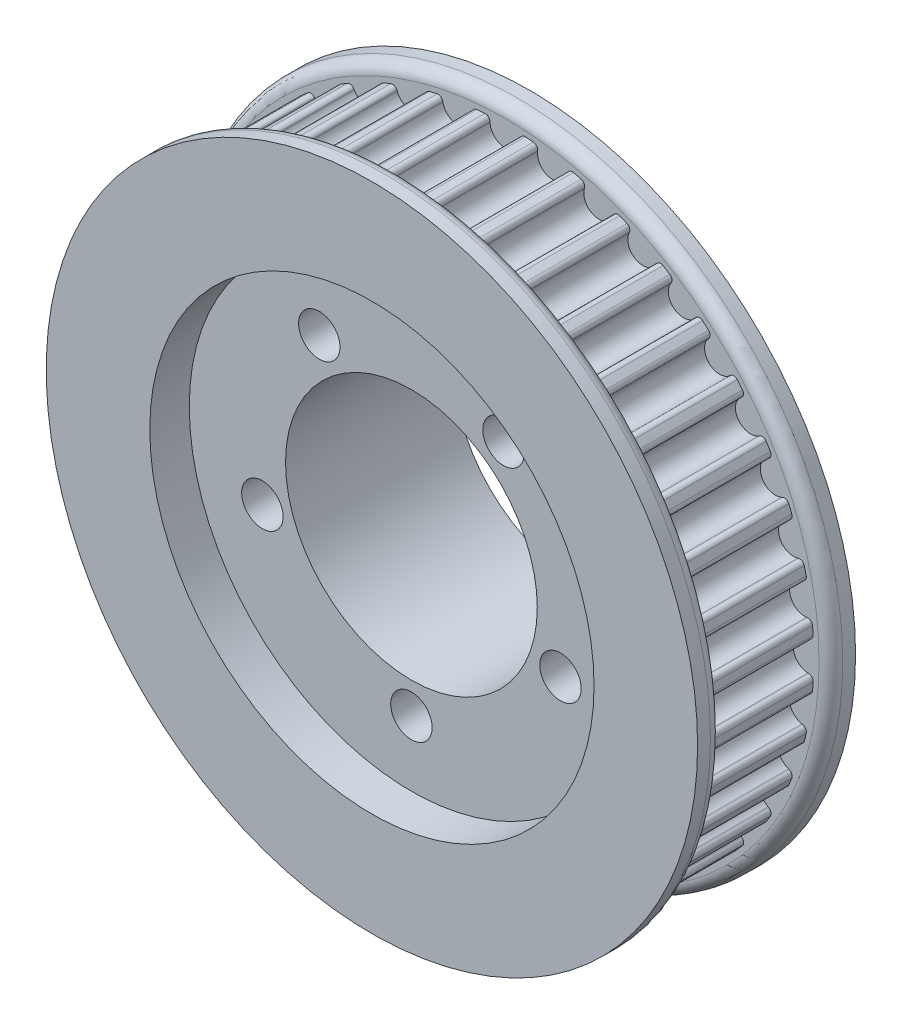
from build123d import *

# Parameters (mm, degrees)
SKETCH_3_R                       = 31.259488618
EXTRUDE_2_DEPTH                  = 5.5
CUT_EXTRUDE_2_DEPTH              = 45.548414757
FILLET_1_R                       = 0.48
PATTERN_CIRCULAR_1_COUNT         = 40
FILLET_1_OF_PATTERN_CIRCULAR_1_R = 0.48
SKETCH_8_R                       = 32.989488618
EXTRUDE_3_DEPTH                  = 2.5
FILLET_2_R                       = 1.2
FILLET_2_OF_MIRROR_1_R           = 1.2
SKETCH_17_R                      = 20
EXTRUDE_4_DEPTH                  = 5
M5X0_8_2_D                       = 4.2
SKETCH_16_R                      = 22.5
CUT_EXTRUDE_4_DEPTH              = 4
SKETCH_18_R                      = 12.75
CUT_EXTRUDE_5_DEPTH              = 52.162610553


with BuildPart() as part:
    # 스케치3 → 보스-돌출2 (new, symmetric)
    with BuildSketch(Plane.XY):
        Circle(SKETCH_3_R)
    extrude(amount=EXTRUDE_2_DEPTH, both=True)

    # 스케치3<3> → 컷-돌출2 (cut, symmetric)
    with BuildSketch(Plane.XY):
        with BuildLine():
            Line((-1.561728679, 31.220452146), (-1.533083111, 30.647799791))
            ThreePointArc((-1.533083111, 30.647799791), (0, 29.189488618), (1.533083111, 30.647799791))
            Line((1.533083111, 30.647799791), (1.561728679, 31.220452146))
            ThreePointArc((1.561728679, 31.220452146), (0, 31.259488618), (-1.561728679, 31.220452146))
        make_face()
    cut_extrude_2 = extrude(amount=CUT_EXTRUDE_2_DEPTH, both=True, mode=Mode.SUBTRACT)

    # 필렛1
    fillet_1_edges = [part.edges().sort_by_distance(p)[0] for p in [
        (1.561728679, 31.220452146, 0),
        (-1.561728679, 31.220452146, 0),
    ]]
    fillet(fillet_1_edges, radius=FILLET_1_R)

    # 원형 패턴1: 컷-돌출2 ×40 about axis
    pattern_circular_1_axis = Axis((0, 0, 5.5), (0, 0, -1))
    for i in range(1, PATTERN_CIRCULAR_1_COUNT):
        add(cut_extrude_2.rotate(pattern_circular_1_axis, i * 360 / PATTERN_CIRCULAR_1_COUNT), mode=Mode.SUBTRACT)

    # 필렛1 of 원형 패턴1
    fillet_1_of_pattern_circular_1_edges = [part.edges().sort_by_distance(p)[0] for p in [
        (6.426455937, 30.591768382, 0),
        (3.341453522, 31.080384763, 0),
        (11.132942522, 29.209813753, 0),
        (8.162358048, 30.175015158, 0),
        (15.565299114, 27.108616567, 0),
        (12.78227823, 28.526636534, 0),
        (19.614386384, 24.339915273, 0),
        (17.087456299, 26.175837444, 0),
        (23.180502364, 20.971884485, 0),
        (20.971884485, 23.180502364, 0),
        (26.175837444, 17.087456299, 0),
        (24.339915273, 19.614386384, 0),
        (28.526636534, 12.78227823, 0),
        (27.108616567, 15.565299114, 0),
        (30.175015158, 8.162358048, 0),
        (29.209813753, 11.132942522, 0),
        (31.080384763, 3.341453522, 0),
        (30.591768382, 6.426455937, 0),
        (31.220452146, -1.561728679, 0),
        (31.220452146, 1.561728679, 0),
        (30.591768382, -6.426455937, 0),
        (31.080384763, -3.341453522, 0),
        (29.209813753, -11.132942522, 0),
        (30.175015158, -8.162358048, 0),
        (27.108616567, -15.565299114, 0),
        (28.526636534, -12.78227823, 0),
        (24.339915273, -19.614386384, 0),
        (26.175837444, -17.087456299, 0),
        (20.971884485, -23.180502364, 0),
        (23.180502364, -20.971884485, 0),
        (17.087456299, -26.175837444, 0),
        (19.614386384, -24.339915273, 0),
        (12.78227823, -28.526636534, 0),
        (15.565299114, -27.108616567, 0),
        (8.162358048, -30.175015158, 0),
        (11.132942522, -29.209813753, 0),
        (3.341453522, -31.080384763, 0),
        (6.426455937, -30.591768382, 0),
        (-1.561728679, -31.220452146, 0),
        (1.561728679, -31.220452146, 0),
        (-6.426455937, -30.591768382, 0),
        (-3.341453522, -31.080384763, 0),
        (-11.132942522, -29.209813753, 0),
        (-8.162358048, -30.175015158, 0),
        (-15.565299114, -27.108616567, 0),
        (-12.78227823, -28.526636534, 0),
        (-19.614386384, -24.339915273, 0),
        (-17.087456299, -26.175837444, 0),
        (-23.180502364, -20.971884485, 0),
        (-20.971884485, -23.180502364, 0),
        (-26.175837444, -17.087456299, 0),
        (-24.339915273, -19.614386384, 0),
        (-28.526636534, -12.78227823, 0),
        (-27.108616567, -15.565299114, 0),
        (-30.175015158, -8.162358048, 0),
        (-29.209813753, -11.132942522, 0),
        (-31.080384763, -3.341453522, 0),
        (-30.591768382, -6.426455937, 0),
        (-31.220452146, 1.561728679, 0),
        (-31.220452146, -1.561728679, 0),
        (-30.591768382, 6.426455937, 0),
        (-31.080384763, 3.341453522, 0),
        (-29.209813753, 11.132942522, 0),
        (-30.175015158, 8.162358048, 0),
        (-27.108616567, 15.565299114, 0),
        (-28.526636534, 12.78227823, 0),
        (-24.339915273, 19.614386384, 0),
        (-26.175837444, 17.087456299, 0),
        (-20.971884485, 23.180502364, 0),
        (-23.180502364, 20.971884485, 0),
        (-17.087456299, 26.175837444, 0),
        (-19.614386384, 24.339915273, 0),
        (-12.78227823, 28.526636534, 0),
        (-15.565299114, 27.108616567, 0),
        (-8.162358048, 30.175015158, 0),
        (-11.132942522, 29.209813753, 0),
        (-3.341453522, 31.080384763, 0),
        (-6.426455937, 30.591768382, 0),
    ]]
    fillet(fillet_1_of_pattern_circular_1_edges, radius=FILLET_1_OF_PATTERN_CIRCULAR_1_R)

    # 스케치8 → 보스-돌출3 (add)
    with BuildSketch(Plane.XY.offset(5.5)):
        Circle(SKETCH_8_R)
    extrude_3 = extrude(amount=EXTRUDE_3_DEPTH)

    # 필렛2
    fillet_2_edges = [part.edges().sort_by_distance(p)[0] for p in [
        (-32.989488618, 0, 5.5),
    ]]
    fillet(fillet_2_edges, radius=FILLET_2_R)

    # 대칭 복사1: 보스-돌출3 across plane
    add(extrude_3.mirror(Plane.XY))

    # 필렛2 of 대칭 복사1
    fillet_2_of_mirror_1_edges = [part.edges().sort_by_distance(p)[0] for p in [
        (-32.989488618, 0, -5.5),
    ]]
    fillet(fillet_2_of_mirror_1_edges, radius=FILLET_2_OF_MIRROR_1_R)

    # 스케치17 → 보스-돌출4 (add)
    with BuildSketch(Plane(origin=(0, 0, -8), x_dir=(-1, 0, 0), z_dir=(0, 0, -1))):
        Circle(SKETCH_17_R)
    extrude(amount=EXTRUDE_4_DEPTH)

    # M5x0.8 탭을 위한 탭 드릴2 (through all)
    with Locations(Plane(origin=(0, 0, 8), x_dir=(-1, 0, 0), z_dir=(0, 0, 1))):
        with Locations((-15.098022196, 4.905644786), (0, 15.875), (15.098022196, 4.905644786), (9.33109088, -12.843144786), (-9.33109088, -12.843144786)):
            Hole(M5X0_8_2_D / 2)

    # 스케치16 → 컷-돌출4 (cut)
    with BuildSketch(Plane.XY.offset(8)):
        Circle(SKETCH_16_R)
    extrude(amount=-CUT_EXTRUDE_4_DEPTH, mode=Mode.SUBTRACT)

    # 스케치18 → 컷-돌출5 (cut, through all)
    with BuildSketch(Plane.XY.offset(8)):
        Circle(SKETCH_18_R)
    extrude(amount=-CUT_EXTRUDE_5_DEPTH, mode=Mode.SUBTRACT)


solid = part.part
